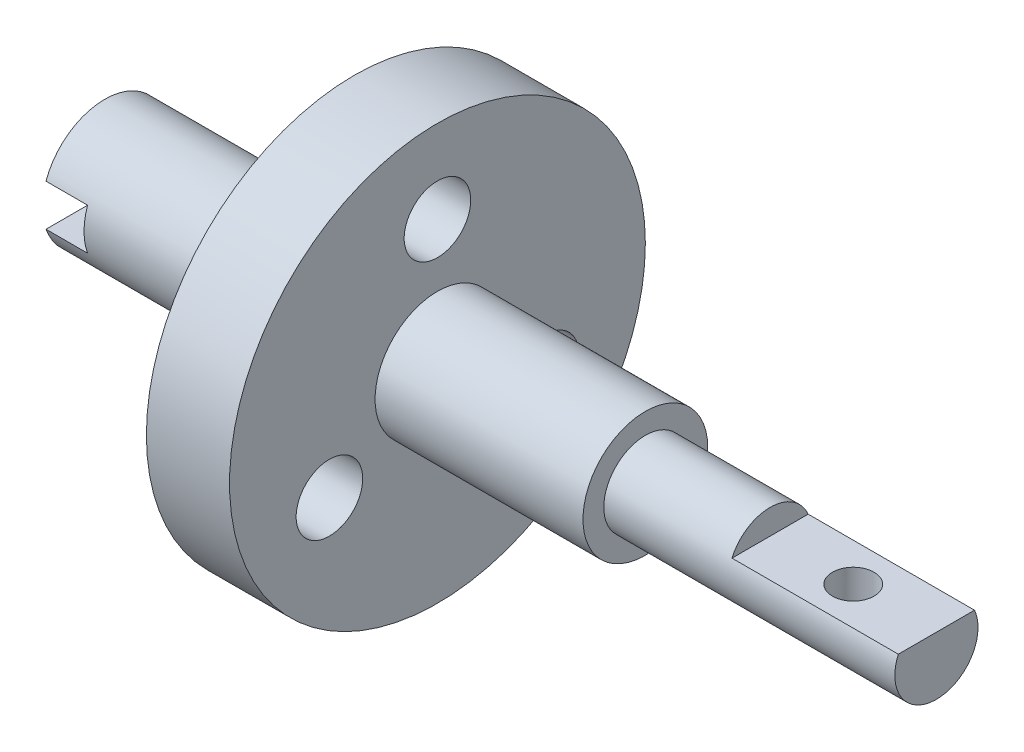
from build123d import *

# Parameters (mm, degrees)
BOSS_EXTRUDE3_DEPTH      = 60
BOSS_EXTRUDE3_DEPTH_BACK = 40
SKETCH1_R                = 25
SKETCH2_OUTSIDE_W        = 76.494
SKETCH2_OUTSIDE_H        = 76.494
SKETCH2_OUTSIDE_R        = 7.5
CUT_EXTRUDE3_DEPTH       = 60
SKETCH4_OUTSIDE_W        = 76.494
SKETCH4_OUTSIDE_H        = 76.494
SKETCH4_OUTSIDE_R        = 7.5
CUT_EXTRUDE4_DEPTH       = 30
SKETCH5_OUTSIDE_W        = 76.494
SKETCH5_OUTSIDE_H        = 76.494
SKETCH5_OUTSIDE_R        = 5
CUT_EXTRUDE5_DEPTH       = 35
CUT_EXTRUDE6_DEPTH       = 20
SKETCH7_R                = 2.5
CUT_EXTRUDE7_DEPTH       = 71.384657419
SKETCH8_R                = 4
CUT_EXTRUDE8_DEPTH       = 20
CUT_EXTRUDE10_DEPTH      = 5


with BuildPart() as part:
    # Sketch1 → Boss-Extrude3 (new, two sides: drawn at the far end of the back side and taken through both)
    with BuildSketch(Plane(origin=(0, 0, 0), x_dir=(0, 0, -1), z_dir=(1, 0, 0)).offset(-BOSS_EXTRUDE3_DEPTH_BACK)):
        Circle(SKETCH1_R)
    extrude(amount=BOSS_EXTRUDE3_DEPTH + BOSS_EXTRUDE3_DEPTH_BACK)

    # Sketch2 outside → Cut-Extrude3 (cut)
    with BuildSketch(Plane(origin=(60, 0, 0), x_dir=(0, 0, -1), z_dir=(1, 0, 0))):
        Rectangle(SKETCH2_OUTSIDE_W, SKETCH2_OUTSIDE_H)
        Circle(SKETCH2_OUTSIDE_R, mode=Mode.SUBTRACT)
    extrude(amount=-CUT_EXTRUDE3_DEPTH, mode=Mode.SUBTRACT)

    # Sketch4 outside → Cut-Extrude4 (cut)
    with BuildSketch(Plane.ZY.offset(40)):
        Rectangle(SKETCH4_OUTSIDE_W, SKETCH4_OUTSIDE_H)
        with Locations(Location((0, 0, 0), (0, 0, 180))):
            Circle(SKETCH4_OUTSIDE_R, mode=Mode.SUBTRACT)
    extrude(amount=-CUT_EXTRUDE4_DEPTH, mode=Mode.SUBTRACT)

    # Sketch5 outside → Cut-Extrude5 (cut)
    with BuildSketch(Plane(origin=(60, 0, 0), x_dir=(0, 0, -1), z_dir=(1, 0, 0))):
        Rectangle(SKETCH5_OUTSIDE_W, SKETCH5_OUTSIDE_H)
        Circle(SKETCH5_OUTSIDE_R, mode=Mode.SUBTRACT)
    extrude(amount=-CUT_EXTRUDE5_DEPTH, mode=Mode.SUBTRACT)

    # Sketch6 → Cut-Extrude6 (cut)
    with BuildSketch(Plane(origin=(60, 0, 0), x_dir=(0, 0, -1), z_dir=(1, 0, 0))):
        with BuildLine():
            Line((-4.582575695, 2), (4.582575695, 2))
            ThreePointArc((4.582575695, 2), (0, 5), (-4.582575695, 2))
        make_face()
    extrude(amount=-CUT_EXTRUDE6_DEPTH, mode=Mode.SUBTRACT)

    # Sketch7 → Cut-Extrude7 (cut, through all)
    with BuildSketch(Plane(origin=(0, 2, 0), x_dir=(1, 0, 0), z_dir=(0, 1, 0))):
        with Locations(Location((50, 0, 0), (0, 0, 270))):
            Circle(SKETCH7_R)
    extrude(amount=-CUT_EXTRUDE7_DEPTH, mode=Mode.SUBTRACT)

    # Sketch8 → Cut-Extrude8 (cut)
    with BuildSketch(Plane(origin=(0, 0, 0), x_dir=(0, 0, -1), z_dir=(1, 0, 0))):
        with Locations((0, 15)):
            Circle(SKETCH8_R)
        with Locations((12.990381057, -7.5)):
            Circle(SKETCH8_R)
        with Locations((-12.990381057, -7.5)):
            Circle(SKETCH8_R)
    extrude(amount=-CUT_EXTRUDE8_DEPTH, mode=Mode.SUBTRACT)

    # Sketch11 → Cut-Extrude10 (cut)
    with BuildSketch(Plane.ZY.offset(40)):
        with BuildLine():
            Line((7.071067812, 2.5), (-7.071067812, 2.5))
            ThreePointArc((-7.071067812, 2.5), (-7.5, 0), (-7.071067812, -2.5))
            Line((-7.071067812, -2.5), (7.071067812, -2.5))
            ThreePointArc((7.071067812, -2.5), (7.391989197, -1.26826484), (7.5, 0))
            ThreePointArc((7.5, 0), (7.391989197, 1.26826484), (7.071067812, 2.5))
        make_face()
    extrude(amount=-CUT_EXTRUDE10_DEPTH, mode=Mode.SUBTRACT)


solid = part.part
